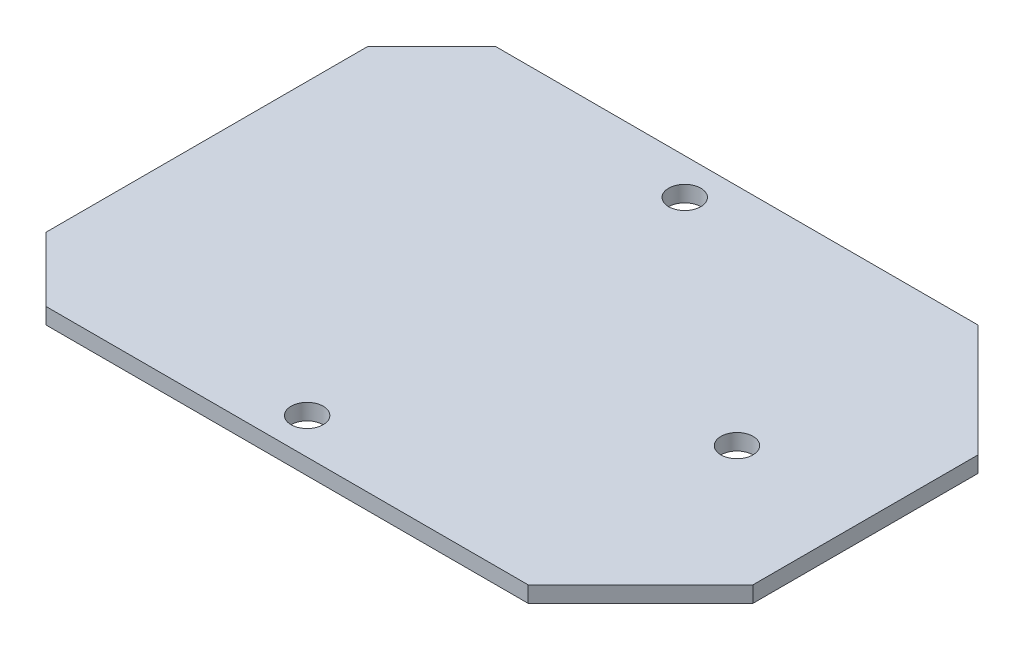
from build123d import *

# Parameters (mm, degrees)
BOSS_EXTRUDE1_DEPTH = 1
SKETCH2_R           = 1
CUT_EXTRUDE1_DEPTH  = 1
SKETCH4_R           = 1
CUT_EXTRUDE2_DEPTH  = 1


with BuildPart() as part:
    # Sketch1 → Boss-Extrude1 (new body)
    with BuildSketch(Plane(origin=(0, 0, 0), x_dir=(1, 0, 0), z_dir=(0, 1, 0))):
        Polygon((-13.58704372, -102.683820402), (-13.58704372, -82.683820402), (-9.58704372, -78.683820402), (20.41295628, -78.683820402), (27.41295628, -85.683820402), (27.41295628, -99.683820402), (20.41295628, -106.683820402), (-9.58704372, -106.683820402), align=None)
    extrude(amount=BOSS_EXTRUDE1_DEPTH)

    # Sketch2 → Cut-Extrude1 (cut)
    with BuildSketch(Plane(origin=(0, 1, 0), x_dir=(1, 0, 0), z_dir=(0, 1, 0))):
        with Locations(Location((19.41295628, -92.683820402, 0), (0, 0, 270))):
            Circle(SKETCH2_R)
    extrude(amount=-CUT_EXTRUDE1_DEPTH, mode=Mode.SUBTRACT)

    # Sketch4 → Cut-Extrude2 (cut)
    with BuildSketch(Plane(origin=(0, 1, 0), x_dir=(1, 0, 0), z_dir=(0, 1, 0))):
        with Locations(Location((4.41295628, -104.433820402, 0), (0, 0, 270))):
            Circle(SKETCH4_R)
        with Locations(Location((4.41295628, -80.933820402, 0), (0, 0, 270))):
            Circle(SKETCH4_R)
    extrude(amount=-CUT_EXTRUDE2_DEPTH, mode=Mode.SUBTRACT)


solid = part.part
